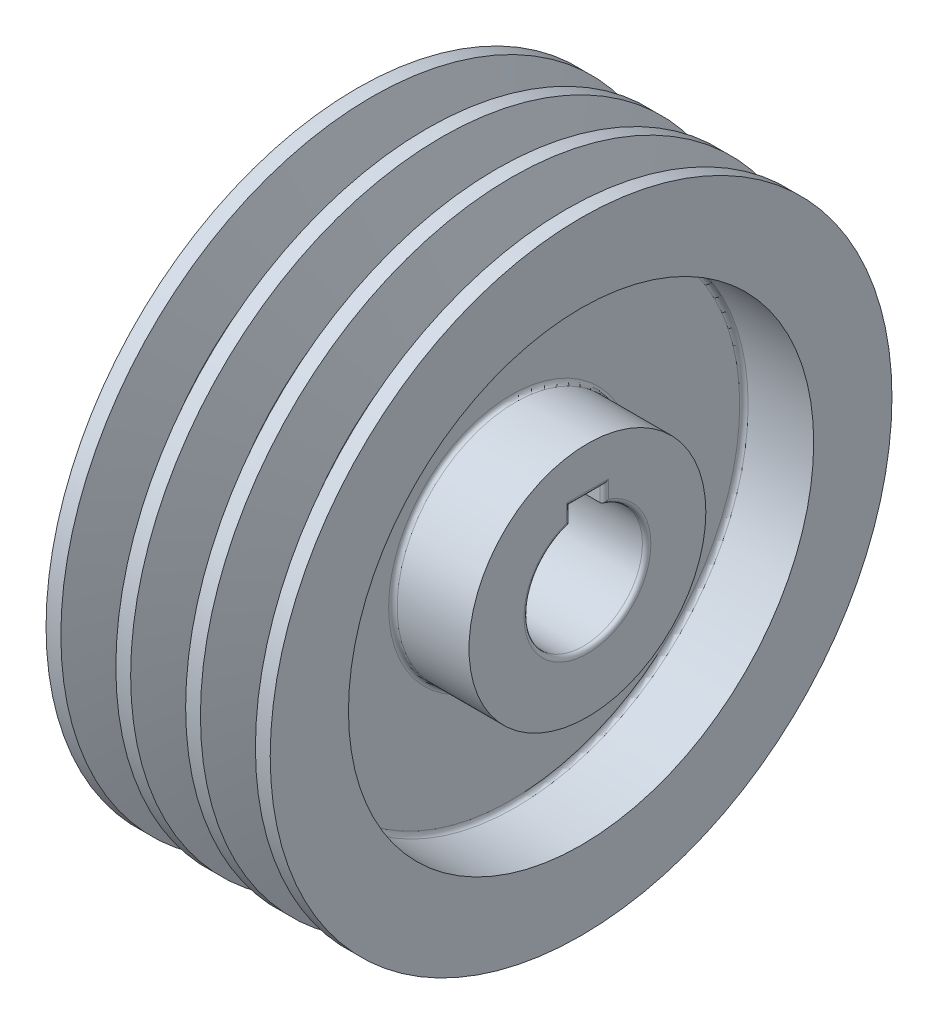
from build123d import *

# Parameters (mm, degrees)
SKETCH_2_R          = 8534.4
EXTRUDE_1_DEPTH     = 8534.4
CUT_EXTRUDE_1_DEPTH = 35988.703860069
SKETCH_6_R          = 16764
SKETCH_6_R_2        = 8534.4
CUT_EXTRUDE_3_DEPTH = 5029.2
FILLET_1_R          = 304.8
FILLET_2_R          = 304.8
FILLET_3_R          = 304.8
FILLET_4_R          = 304.8


with BuildPart() as part:
    # 草图1 → 旋转3 (revolve)
    with BuildSketch(Plane.XY, mode=Mode.PRIVATE) as revolve_3_sk:
        Polygon((-5772.455957353, 18592.8), (-7010.4, 22402.8), (-8077.2, 22402.8), (-8077.2, 0), (8077.2, 0), (8077.2, 22402.8), (7010.4, 22402.8), (5772.455957353, 18592.8), (4285.944042647, 18592.8), (3048, 22402.8), (1981.2, 22402.8), (743.255957353, 18592.8), (-743.255957353, 18592.8), (-1981.2, 22402.8), (-3048, 22402.8), (-4285.944042647, 18592.8), align=None)
        Polygon((-1.110965292, 2.756288048), (-0.854995928, 3.53841666), (-0.158190438, 3.53841666), (0, 3.080496972), (0.158190438, 3.53841666), (0.854995928, 3.53841666), (1.110965292, 2.756288048), (0.111999447, 2.756288048), (-0.111999447, 2.756288048), align=None, mode=Mode.SUBTRACT)
    revolve(revolve_3_sk.sketch.rotate(Axis((-4.554564206, 0, 0), (1, 0, 0)), 90), axis=Axis((-4.554564206, 0, 0), (1, 0, 0)))

    # 草图2 → 凸台-拉伸1 (add, symmetric)
    with BuildSketch(Plane(origin=(0, 0, 0), x_dir=(0, 0, -1), z_dir=(1, 0, 0))):
        Circle(SKETCH_2_R)
    extrude(amount=EXTRUDE_1_DEPTH, both=True)

    # 草图3 → 切除-拉伸1 (cut, through all)
    with BuildSketch(Plane(origin=(8534.4, 0, 0), x_dir=(0, 0, -1), z_dir=(1, 0, 0))):
        with BuildLine():
            Line((-1219.2, 4089.321117252), (-1219.2, 5273.04))
            Line((-1219.2, 5273.04), (1219.2, 5273.04))
            Line((1219.2, 5273.04), (1219.2, 4089.321117252))
            ThreePointArc((1219.2, 4089.321117252), (0, -4267.2), (-1219.2, 4089.321117252))
        make_face()
    extrude(amount=-CUT_EXTRUDE_1_DEPTH, mode=Mode.SUBTRACT)

    # 草图6 → 切除-拉伸3 (cut)
    with BuildSketch(Plane(origin=(8077.2, 0, 0), x_dir=(0, 0, -1), z_dir=(1, 0, 0))):
        Circle(SKETCH_6_R)
        Circle(SKETCH_6_R_2, mode=Mode.SUBTRACT)
    cut_extrude_3 = extrude(amount=-CUT_EXTRUDE_3_DEPTH, mode=Mode.SUBTRACT)

    # 镜向1: 切除-拉伸3 across plane
    add(cut_extrude_3.mirror(Plane(origin=(0, 0, 0), x_dir=(0, 0, 1), z_dir=(1, 0, 0))), mode=Mode.SUBTRACT)

    # 圆角1
    fillet_1_edges = [part.edges().sort_by_distance(p)[0] for p in [
        (8534.4, 4681.180558626, -1219.2),
        (8534.4, 5273.04, 0),
        (8534.4, 4681.180558626, 1219.2),
        (8534.4, -4267.2, 0),
    ]]
    fillet(fillet_1_edges, radius=FILLET_1_R)

    # 圆角2
    fillet_2_edges = [part.edges().sort_by_distance(p)[0] for p in [
        (-8534.4, 4681.180558626, -1219.2),
        (-8534.4, -4267.2, 0),
        (-8534.4, 4681.180558626, 1219.2),
        (-8534.4, 5273.04, 0),
    ]]
    fillet(fillet_2_edges, radius=FILLET_2_R)

    # 圆角3
    fillet_3_edges = [part.edges().sort_by_distance(p)[0] for p in [
        (3048, 0, 16764),
    ]]
    fillet(fillet_3_edges, radius=FILLET_3_R)

    # 圆角4
    fillet_4_edges = [part.edges().sort_by_distance(p)[0] for p in [
        (3048, 0, 8534.4),
        (-3048, 0, 16764),
        (-3048, 0, 8534.4),
    ]]
    fillet(fillet_4_edges, radius=FILLET_4_R)


solid = part.part
